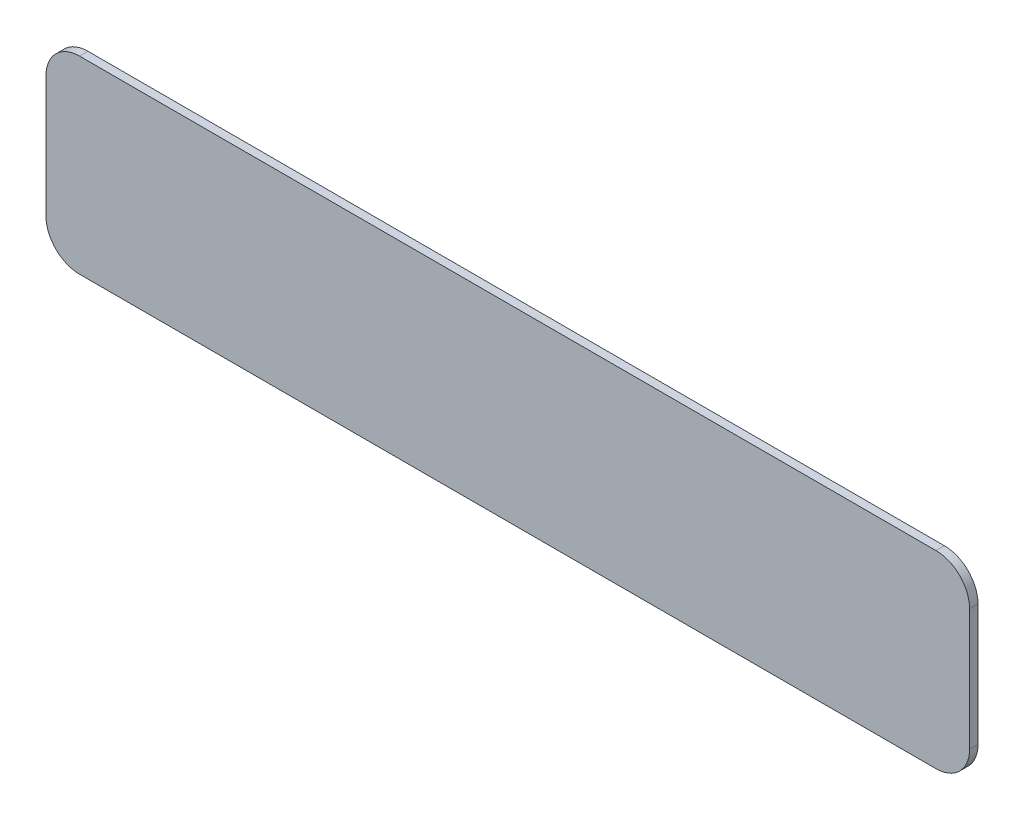
from build123d import *

# Parameters (mm, degrees)
BOSS_EXTRUDE1_DEPTH = 1


with BuildPart() as part:
    # Sketch1 → Boss-Extrude1 (new body)
    with BuildSketch(Plane.XY):
        with BuildLine():
            Line((-51, 11.25), (51, 11.25))
            ThreePointArc((51, 11.25), (53.828427125, 10.078427125), (55, 7.25))
            Line((55, 7.25), (55, -7.25))
            ThreePointArc((55, -7.25), (53.828427125, -10.078427125), (51, -11.25))
            Line((51, -11.25), (-51, -11.25))
            ThreePointArc((-51, -11.25), (-53.828427125, -10.078427125), (-55, -7.25))
            Line((-55, -7.25), (-55, 7.25))
            ThreePointArc((-55, 7.25), (-53.828427125, 10.078427125), (-51, 11.25))
        make_face()
    extrude(amount=BOSS_EXTRUDE1_DEPTH)


solid = part.part
